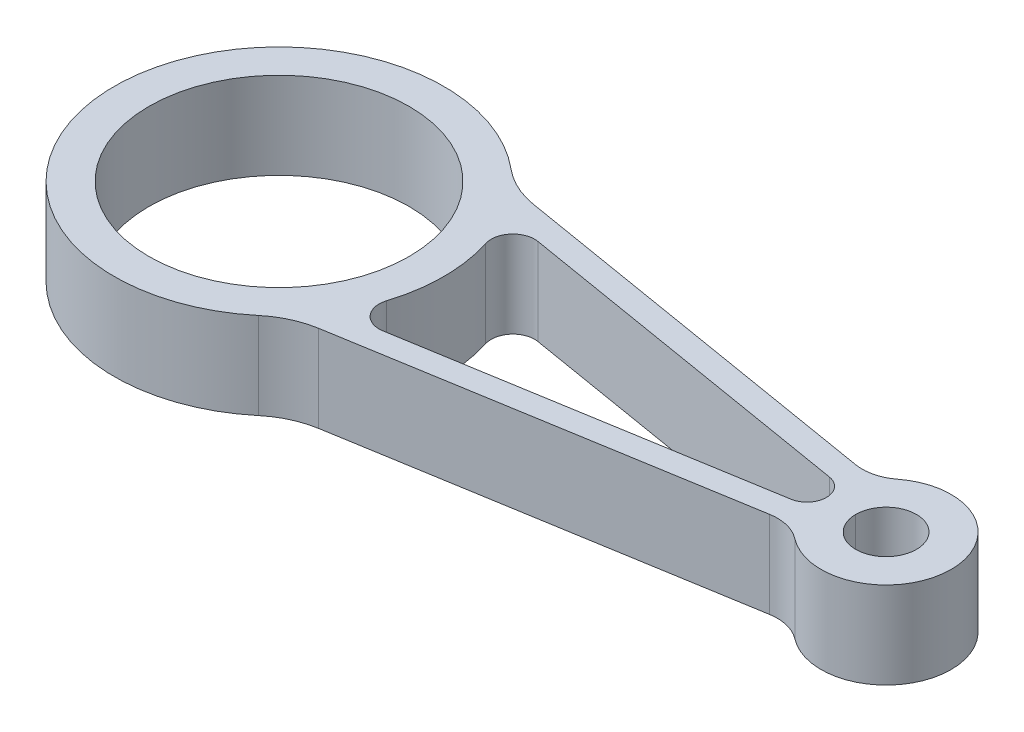
from build123d import *

# Parameters (mm, degrees)
SKETCH1_R           = 30
SKETCH1_R_2         = 7
BOSS_EXTRUDE1_DEPTH = 10
FILLET1_R           = 10
FILLET2_R           = 20
CUT_EXTRUDE1_DEPTH  = 161.838428244


with BuildPart() as part:
    # Sketch1 → Boss-Extrude1 (new, symmetric)
    with BuildSketch(Plane(origin=(0, 0, 0), x_dir=(1, 0, 0), z_dir=(0, 1, 0))):
        with BuildLine():
            Line((27.935473676, 25.760615491), (128.063755469, 9.084385863))
            ThreePointArc((128.063755469, 9.084385863), (155, 0), (128.063755469, -9.084385863))
            Line((128.063755469, -9.084385863), (27.935473676, -25.760615491))
            ThreePointArc((27.935473676, -25.760615491), (-38, 0), (27.935473676, 25.760615491))
        make_face()
        with Locations(Location((0, 0, 0), (0, 0, 270))):
            Circle(SKETCH1_R, mode=Mode.SUBTRACT)
        with Locations(Location((140, 0, 0), (0, 0, 270))):
            Circle(SKETCH1_R_2, mode=Mode.SUBTRACT)
    extrude(amount=BOSS_EXTRUDE1_DEPTH, both=True)

    # Fillet1
    fillet1_edges = [part.edges().sort_by_distance(p)[0] for p in [
        (128.063755469, 0, -9.084385863),
        (128.063755469, 0, 9.084385863),
    ]]
    fillet(fillet1_edges, radius=FILLET1_R)

    # Fillet2
    fillet2_edges = [part.edges().sort_by_distance(p)[0] for p in [
        (27.935473676, 0, -25.760615491),
        (27.935473676, 0, 25.760615491),
    ]]
    fillet(fillet2_edges, radius=FILLET2_R)

    # Sketch2 → Cut-Extrude1 (cut, through all)
    with BuildSketch(Plane(origin=(0, 10, 0), x_dir=(1, 0, 0), z_dir=(0, 1, 0))):
        with BuildLine():
            Line((41.828554558, 17.870982725), (122.478416149, 4.438857582))
            ThreePointArc((122.478416149, 4.438857582), (126.238334256, -0.084646201), (122.310930345, -4.463523817))
            Line((122.310930345, -4.463523817), (41.652034204, -17.897153652))
            ThreePointArc((41.652034204, -17.897153652), (37.174066261, -16.149472145), (36.238855523, -11.43439331))
            ThreePointArc((36.238855523, -11.43439331), (38, 0), (36.238855523, 11.43439331))
            ThreePointArc((36.238855523, 11.43439331), (37.231968897, 16.217361812), (41.828554558, 17.870982725))
        make_face()
    extrude(amount=-CUT_EXTRUDE1_DEPTH, mode=Mode.SUBTRACT)


solid = part.part
